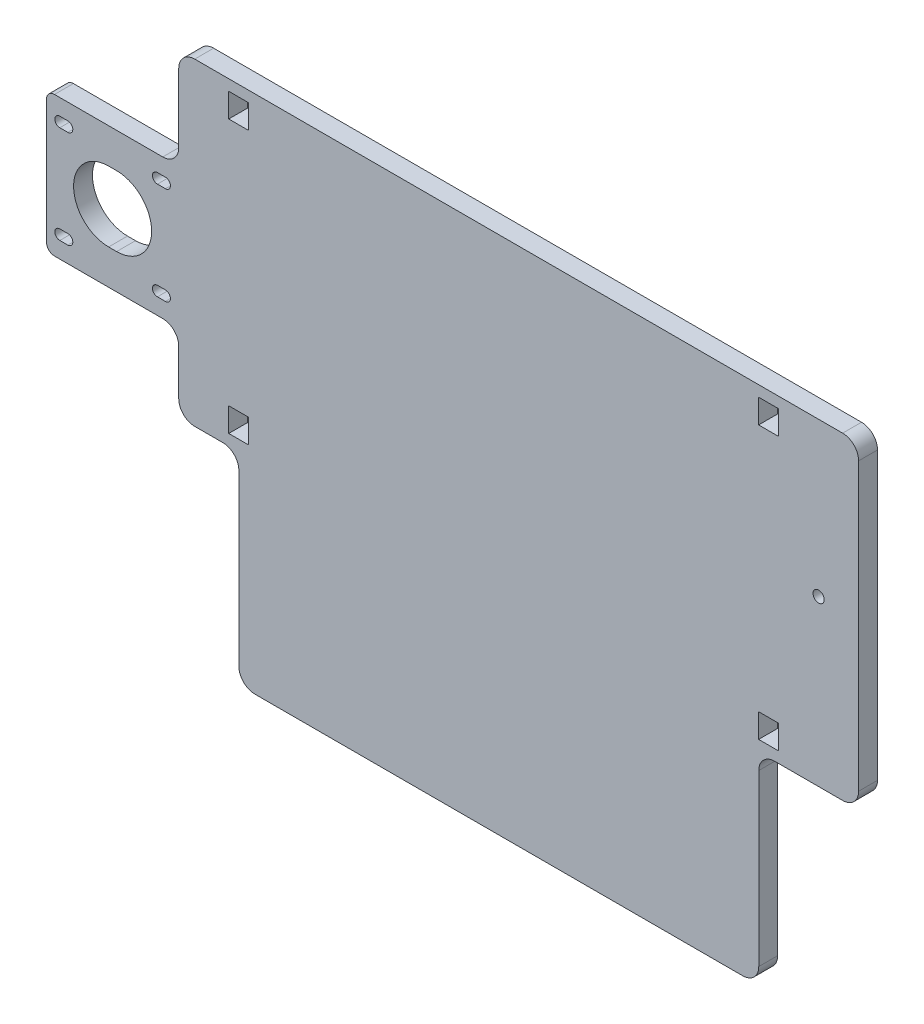
from build123d import *

# Parameters (mm, degrees)
SKETCH1_W           = 257.9
SKETCH1_H           = 165.1
SKETCH1_W_2         = 6.35
SKETCH1_H_2         = 7.62
BOSS_EXTRUDE1_DEPTH = 6
SKETCH2_R           = 1.778
CUT_EXTRUDE1_DEPTH  = 307.278337464
SKETCH3_W           = 42
SKETCH3_H           = 31.9913
SKETCH3_W_2         = 31.713
SKETCH3_H_2         = 64.0842
CUT_EXTRUDE2_DEPTH  = 307.278337464
FILLET1_R           = 5.08
FILLET2_R           = 2.54


with BuildPart() as part:
    # Sketch1 → Boss-Extrude1 (new body)
    with BuildSketch(Plane.XY):
        with Locations((128.95, 82.55)):
            Rectangle(SKETCH1_W, SKETCH1_H)
        with Locations((229.325, 157.8356)):
            Rectangle(SKETCH1_W_2, SKETCH1_H_2, mode=Mode.SUBTRACT)
        with Locations((61.05, 157.8356)):
            Rectangle(SKETCH1_W_2, SKETCH1_H_2, mode=Mode.SUBTRACT)
        with Locations((229.325, 71.3486)):
            Rectangle(SKETCH1_W_2, SKETCH1_H_2, mode=Mode.SUBTRACT)
        with Locations((61.05, 71.3486)):
            Rectangle(SKETCH1_W_2, SKETCH1_H_2, mode=Mode.SUBTRACT)
    extrude(amount=BOSS_EXTRUDE1_DEPTH)

    # Sketch2 → Cut-Extrude1 (cut, through all)
    with BuildSketch(Plane.XY.offset(6)):
        with Locations((245.2, 116.3447)):
            Circle(SKETCH2_R)
        with BuildLine():
            Line((4.23, 127.9712), (6.77, 127.9712))
            ThreePointArc((6.77, 127.9712), (8.3575, 126.3837), (6.77, 124.7962))
            Line((6.77, 124.7962), (4.23, 124.7962))
            ThreePointArc((4.23, 124.7962), (2.6425, 126.3837), (4.23, 127.9712))
        make_face()
        with BuildLine():
            Line((35.23, 127.9712), (37.77, 127.9712))
            ThreePointArc((37.77, 127.9712), (39.3575, 126.3837), (37.77, 124.7962))
            Line((37.77, 124.7962), (35.23, 124.7962))
            ThreePointArc((35.23, 124.7962), (33.6425, 126.3837), (35.23, 127.9712))
        make_face()
        with BuildLine():
            Line((35.23, 96.9712), (37.77, 96.9712))
            ThreePointArc((37.77, 96.9712), (39.3575, 95.3837), (37.77, 93.7962))
            Line((37.77, 93.7962), (35.23, 93.7962))
            ThreePointArc((35.23, 93.7962), (33.6425, 95.3837), (35.23, 96.9712))
        make_face()
        with BuildLine():
            Line((4.23, 96.9712), (6.77, 96.9712))
            ThreePointArc((6.77, 96.9712), (8.3575, 95.3837), (6.77, 93.7962))
            Line((6.77, 93.7962), (4.23, 93.7962))
            ThreePointArc((4.23, 93.7962), (2.6425, 95.3837), (4.23, 96.9712))
        make_face()
        with BuildLine():
            Line((19.73, 122.0087), (22.27, 122.0087))
            ThreePointArc((22.27, 122.0087), (33.395, 110.8837), (22.27, 99.7587))
            Line((22.27, 99.7587), (19.73, 99.7587))
            ThreePointArc((19.73, 99.7587), (8.605, 110.8837), (19.73, 122.0087))
        make_face()
    extrude(amount=-CUT_EXTRUDE1_DEPTH, mode=Mode.SUBTRACT)

    # Sketch3 → Cut-Extrude2 (cut, through all)
    with BuildSketch(Plane.XY.offset(6)):
        Polygon((61.087, 0), (61.087, 64.0842), (42, 64.0842), (42, 88.6587), (0, 88.6587), (0, 0), align=None)
        with Locations((21, 149.10435)):
            Rectangle(SKETCH3_W, SKETCH3_H)
        with Locations((242.0435, 32.0421)):
            Rectangle(SKETCH3_W_2, SKETCH3_H_2)
    extrude(amount=-CUT_EXTRUDE2_DEPTH, mode=Mode.SUBTRACT)

    # Fillet1
    fillet1_edges = [part.edges().sort_by_distance(p)[0] for p in [
        (61.087, 0, 3),
        (42, 88.6587, 3),
        (42, 64.0842, 3),
        (61.087, 64.0842, 3),
        (42, 165.1, 3),
        (42, 133.1087, 3),
        (226.187, 0, 3),
        (226.187, 64.0842, 3),
        (257.9, 64.0842, 3),
        (257.9, 165.1, 3),
    ]]
    fillet(fillet1_edges, radius=FILLET1_R)

    # Fillet2
    fillet2_edges = [part.edges().sort_by_distance(p)[0] for p in [
        (0, 88.6587, 3),
        (0, 133.1087, 3),
    ]]
    fillet(fillet2_edges, radius=FILLET2_R)


solid = part.part
